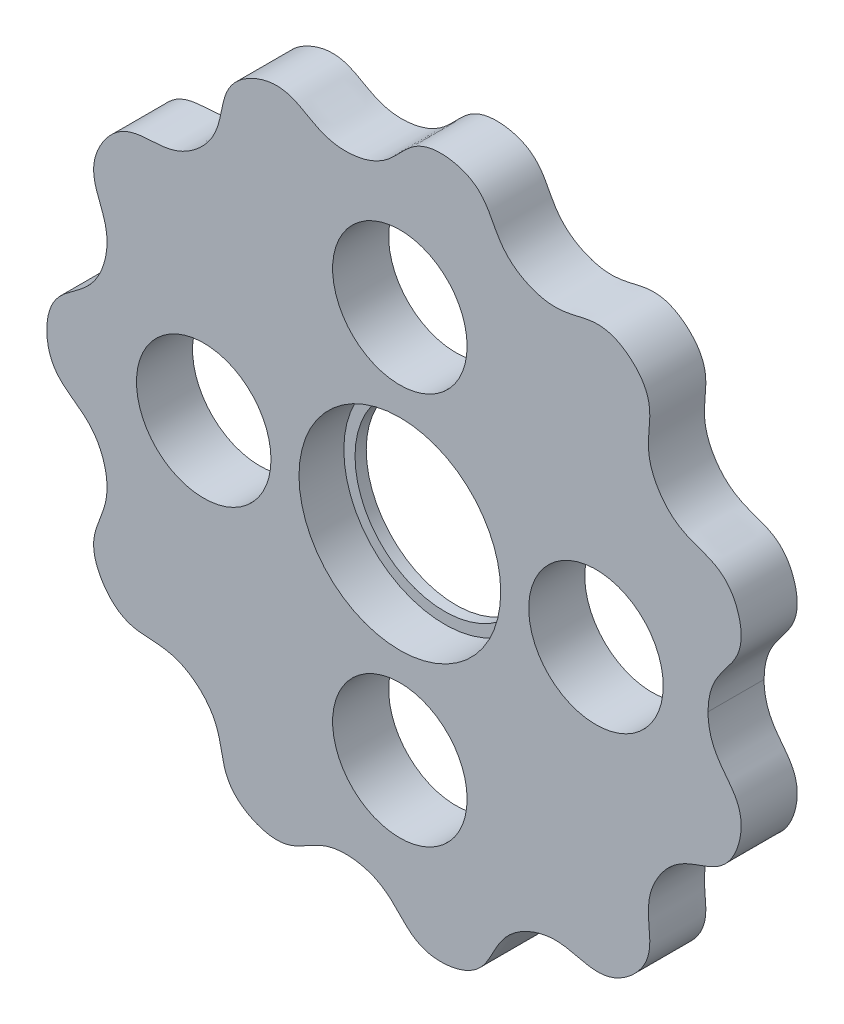
from build123d import *

# Parameters (mm, degrees)
SKETCH2_R           = 9
SKETCH2_R_2         = 6
BOSS_EXTRUDE2_DEPTH = 5
SKETCH3_R           = 9
SKETCH3_R_2         = 8
BOSS_EXTRUDE3_DEPTH = 1


with BuildPart() as part:
    # Sketch2 → Boss-Extrude2 (new body)
    with BuildSketch(Plane.XY):
        with BuildLine():
            add(Edge.make_bspline(
                [(-29.5, 1.371e-06), (-29.500000135, -0.406706394), (-29.455003316, -0.948983445), (-29.323760239, -1.605418219), (-29.037497169, -2.31821183), (-28.380280445, -3.221433881), (-27.710255565, -3.800690064), (-26.516658004, -4.598682391), (-25.086637602, -5.721640729), (-24.34317886, -7.452187853), (-23.911514102, -9.305515833), (-24.282393778, -11.06231119), (-24.797568515, -12.265767319), (-25.129771033, -13.107109723), (-25.366000391, -14.207009238), (-25.349462185, -15.08028683), (-25.030906887, -16.215230378), (-24.404835565, -17.305230784), (-23.587633534, -18.211321316), (-22.857084204, -18.730341733), (-21.815879606, -19.134862288), (-20.939049272, -19.259920799), (-19.503503884, -19.285927102), (-17.693377054, -19.457492372), (-16.132335349, -20.511377111), (-14.767211093, -21.837120235), (-14.129419652, -23.515543227), (-13.912174715, -24.806479438), (-13.736777212, -25.693863948), (-13.34085542, -26.746873534), (-12.854813085, -27.472580165), (-11.973230508, -28.255131437), (-10.857247086, -28.833618419), (-9.679903464, -29.154057506), (-8.784722637, -29.195720478), (-7.690105267, -28.973107119), (-6.884856915, -28.604262764), (-5.663139217, -27.850026227), (-4.047608438, -27.015727667), (-2.164603482, -27.058349064), (-0.299437033, -27.435593256), (1.144531248, -28.502756442), (2.025222128, -29.47130961), (2.652532184, -30.122997914), (3.554902753, -30.794794468), (4.356134211, -31.142523409), (5.520847828, -31.324227906), (6.772426499, -31.207535934), (7.93611343, -30.84058643), (8.711712166, -30.391664258), (9.512209028, -29.612595153), (9.990214735, -28.86695341), (10.610218007, -27.571938803), (11.518233126, -25.996660312), (13.125360564, -25.014486374), (14.898392038, -24.323459269), (16.690087433, -24.440545877), (17.954611123, -24.779207214), (18.834667222, -24.988292882), (19.956990289, -25.065585743), (20.819025542, -24.924935514), (21.897081855, -24.448103342), (22.88688839, -23.673281292), (23.667456252, -22.735447071), (24.077225779, -21.938469374), (24.329450035, -20.850293459), (24.328449663, -19.964590312), (24.14989185, -18.539955623), (24.062102926, -16.723836991), (24.88310124, -15.028701004), (26.001072772, -13.488798826), (27.571644653, -12.618634685), (28.818523817, -12.21988161), (29.671914364, -11.919981418), (30.657860286, -11.37823065), (31.307009233, -10.793856704), (31.956132979, -9.809878708), (32.369910798, -8.622927107), (32.51953481, -7.411963909), (32.433376198, -6.519965473), (32.057248428, -5.468170913), (31.577559588, -4.723610853), (30.657131534, -3.62166753), (29.903045388, -2.564271859), (29.593731166, -1.439244501), (29.500000103, -0.654201983), (29.5, 0)],
                knots=[0.5, 0.5, 0.5, 0.5, 0.5, 0.5, 0.509090909, 0.512121212, 0.515151515, 0.518181818, 0.527272727, 0.53030303, 0.545454545, 0.557575758, 0.560606061, 0.56969697, 0.572727273, 0.575757576, 0.578787879, 0.587878788, 0.590909091, 0.6, 0.603030303, 0.606060606, 0.609090909, 0.618181818, 0.621212121, 0.636363636, 0.648484848, 0.651515152, 0.660606061, 0.663636364, 0.666666667, 0.66969697, 0.678787879, 0.681818182, 0.690909091, 0.693939394, 0.696969697, 0.7, 0.709090909, 0.712121212, 0.727272727, 0.739393939, 0.742424242, 0.751515152, 0.754545455, 0.757575758, 0.760606061, 0.76969697, 0.772727273, 0.781818182, 0.784848485, 0.787878788, 0.790909091, 0.8, 0.803030303, 0.818181818, 0.83030303, 0.833333333, 0.842424242, 0.845454545, 0.848484848, 0.851515152, 0.860606061, 0.863636364, 0.872727273, 0.875757576, 0.878787879, 0.881818182, 0.890909091, 0.893939394, 0.909090909, 0.921212121, 0.924242424, 0.933333333, 0.936363636, 0.939393939, 0.942424242, 0.951515152, 0.954545455, 0.963636364, 0.966666667, 0.96969697, 0.972727273, 0.981818182, 0.984848485, 1, 1, 1, 1, 1, 1], degree=5, weights=[1, 1, 1, 1, 1, 1, 1, 1, 1, 1, 1, 1, 1, 1, 1, 1, 1, 1, 1, 1, 1, 1, 1, 1, 1, 1, 1, 1, 1, 1, 1, 1, 1, 1, 1, 1, 1, 1, 1, 1, 1, 1, 1, 1, 1, 1, 1, 1, 1, 1, 1, 1, 1, 1, 1, 1, 1, 1, 1, 1, 1, 1, 1, 1, 1, 1, 1, 1, 1, 1, 1, 1, 1, 1, 1, 1, 1, 1, 1, 1, 1, 1, 1, 1, 1, 1, 1]))
            add(Edge.make_bspline(
                [(29.5, 0), (29.499999897, 0.654201983), (29.593730713, 1.439244226), (29.868677252, 2.439267293), (30.50631134, 3.410187619), (31.32653884, 4.423075738), (31.783139541, 5.042705741), (32.260062129, 5.921632279), (32.490224566, 6.764195344), (32.504323543, 7.942913102), (32.21070111, 9.165145508), (31.681876706, 10.264765424), (31.127144706, 10.968581398), (30.24208282, 11.650057262), (29.436003329, 12.017081676), (28.065934438, 12.446474414), (26.377465986, 13.121061745), (25.176571081, 14.572053018), (24.240248948, 16.228694177), (24.101158943, 18.018815858), (24.256412712, 19.318665054), (24.338125147, 20.219519443), (24.254908053, 21.341418801), (23.993009032, 22.174663164), (23.367606915, 23.173886124), (22.459807279, 24.043349181), (21.42043247, 24.682504263), (20.573250572, 24.974681175), (19.460255465, 25.069474571), (18.583709867, 24.942435682), (17.198987331, 24.562948674), (15.413847834, 24.217592686), (13.619125645, 24.788991417), (11.935793513, 25.676432681), (10.850970706, 27.107181136), (10.278826955, 28.284620388), (9.860529177, 29.086644404), (9.183977917, 29.985455644), (8.513168527, 30.544832107), (7.446826067, 31.04731404), (6.213069199, 31.287959372), (4.993138143, 31.263722396), (4.122480614, 31.051496141), (3.134920369, 30.529510837), (2.466205696, 29.948742594), (1.506469137, 28.880860284), (0.191427773, 27.625209062), (-1.627310086, 27.135600192), (-3.52320616, 26.972085231), (-5.209338193, 27.589207933), (-6.327227864, 28.270408599), (-7.112729268, 28.718965282), (-8.167814449, 29.109322187), (-9.034556967, 29.217232676), (-10.203283571, 29.063439119), (-11.371288584, 28.598863532), (-12.384456396, 27.918929567), (-13.002161942, 27.269680483), (-13.550743926, 26.296643123), (-13.799315488, 25.446535339), (-14.029356495, 24.029302816), (-14.456783385, 22.262016751), (-15.722100495, 20.866847636), (-17.228626902, 19.704291295), (-18.980733154, 19.311856148), (-20.289446674, 19.280541829), (-21.192760557, 19.233217603), (-22.291397569, 18.991184613), (-23.078888589, 18.61336831), (-23.978936899, 17.85212763), (-24.710356718, 16.829830591), (-25.195087664, 15.710073867), (-25.363724082, 14.829933949), (-25.2991569, 13.714777021), (-25.048665638, 12.865232912), (-24.475974698, 11.548611487), (-23.880082096, 9.830791418), (-24.190249214, 7.973018395), (-24.829094466, 6.180524097), (-26.090893582, 4.903126487), (-27.174923655, 4.169239258), (-27.909254242, 3.641059229), (-28.702633596, 2.843480109), (-29.160850284, 2.099891021), (-29.391256808, 1.348557351), (-29.485000774, 0.677847635), (-29.499999955, 0.135570626), (-29.5, 1.371e-06)],
                knots=[0, 0, 0, 0, 0, 0, 0.015151515, 0.018181818, 0.024242424, 0.027272727, 0.03030303, 0.033333333, 0.042424242, 0.045454545, 0.054545455, 0.057575758, 0.060606061, 0.063636364, 0.072727273, 0.075757576, 0.090909091, 0.103030303, 0.106060606, 0.115151515, 0.118181818, 0.121212121, 0.124242424, 0.133333333, 0.136363636, 0.145454545, 0.148484848, 0.151515152, 0.154545455, 0.163636364, 0.166666667, 0.181818182, 0.193939394, 0.196969697, 0.206060606, 0.209090909, 0.212121212, 0.215151515, 0.224242424, 0.227272727, 0.236363636, 0.239393939, 0.242424242, 0.245454545, 0.254545455, 0.257575758, 0.272727273, 0.284848485, 0.287878788, 0.296969697, 0.3, 0.303030303, 0.306060606, 0.315151515, 0.318181818, 0.327272727, 0.33030303, 0.333333333, 0.336363636, 0.345454545, 0.348484848, 0.363636364, 0.375757576, 0.378787879, 0.387878788, 0.390909091, 0.393939394, 0.396969697, 0.406060606, 0.409090909, 0.418181818, 0.421212121, 0.424242424, 0.427272727, 0.436363636, 0.439393939, 0.454545455, 0.466666667, 0.46969697, 0.478787879, 0.481818182, 0.484848485, 0.487878788, 0.496969697, 0.5, 0.5, 0.5, 0.5, 0.5, 0.5], degree=5, weights=[1, 1, 1, 1, 1, 1, 1, 1, 1, 1, 1, 1, 1, 1, 1, 1, 1, 1, 1, 1, 1, 1, 1, 1, 1, 1, 1, 1, 1, 1, 1, 1, 1, 1, 1, 1, 1, 1, 1, 1, 1, 1, 1, 1, 1, 1, 1, 1, 1, 1, 1, 1, 1, 1, 1, 1, 1, 1, 1, 1, 1, 1, 1, 1, 1, 1, 1, 1, 1, 1, 1, 1, 1, 1, 1, 1, 1, 1, 1, 1, 1, 1, 1, 1, 1, 1, 1, 1]))
        make_face()
        with Locations((2, 0)):
            Circle(SKETCH2_R, mode=Mode.SUBTRACT)
        with Locations((19.5, 0)):
            Circle(SKETCH2_R_2, mode=Mode.SUBTRACT)
        with Locations((2, 17.5)):
            Circle(SKETCH2_R_2, mode=Mode.SUBTRACT)
        with Locations((-15.5, 0)):
            Circle(SKETCH2_R_2, mode=Mode.SUBTRACT)
        with Locations((2, -17.5)):
            Circle(SKETCH2_R_2, mode=Mode.SUBTRACT)
    extrude(amount=BOSS_EXTRUDE2_DEPTH)

    # Sketch3 → Boss-Extrude3 (add)
    with BuildSketch(Plane(origin=(0, 0, 0), x_dir=(-1, 0, 0), z_dir=(0, 0, -1))):
        with Locations((-2, 0)):
            Circle(SKETCH3_R)
        with Locations((-2, 0)):
            Circle(SKETCH3_R_2, mode=Mode.SUBTRACT)
    extrude(amount=-BOSS_EXTRUDE3_DEPTH)


solid = part.part
